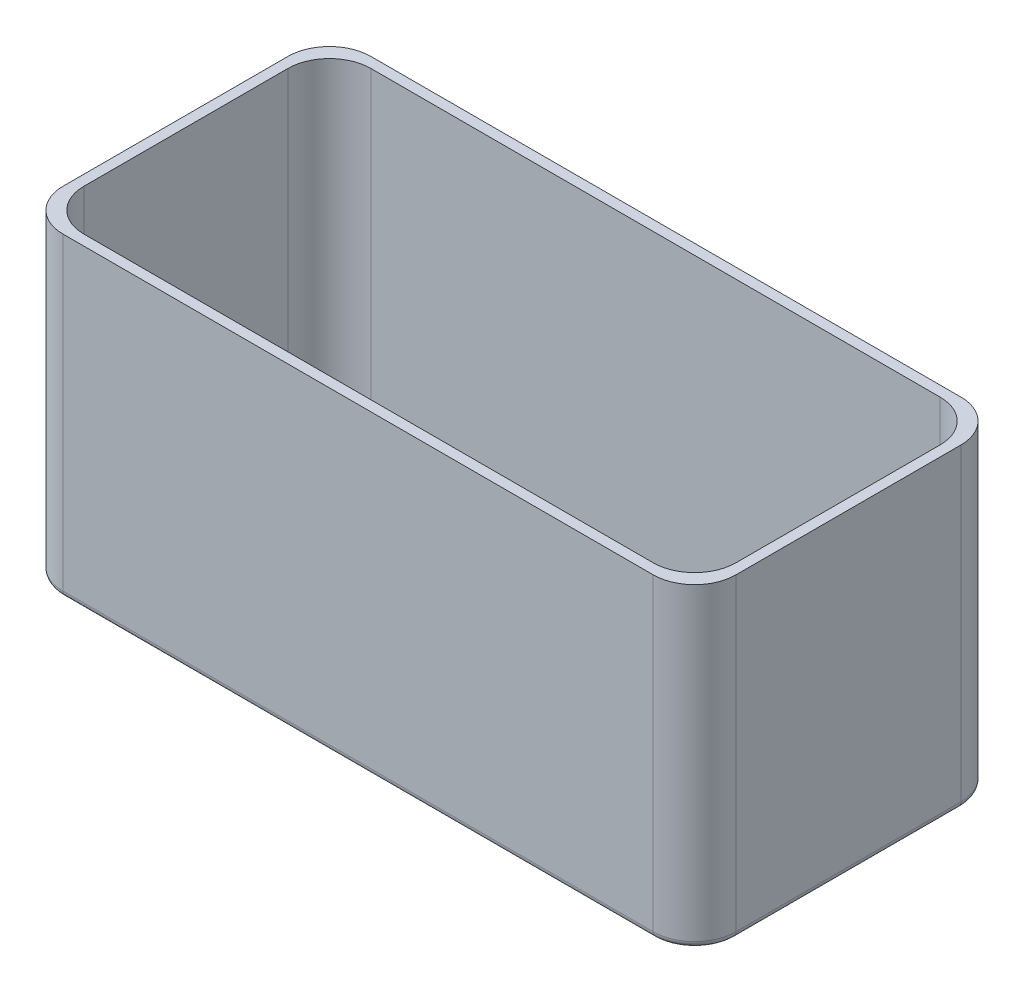
from build123d import *

# Parameters (mm, degrees)
SKETCH4_W           = 51.6
SKETCH4_H           = 23.6
SKETCH4_W_2         = 50
SKETCH4_H_2         = 22
BOSS_EXTRUDE2_DEPTH = 24.2
SKETCH4_2_W         = 50
SKETCH4_2_H         = 22
BOSS_EXTRUDE3_DEPTH = 0.8
FILLET3_R           = 3.18
FILLET4_R           = 0.5


with BuildPart() as part:
    # Sketch4 → Boss-Extrude2 (new body)
    with BuildSketch(Plane(origin=(0, 0, 0), x_dir=(1, 0, 0), z_dir=(0, 1, 0))):
        Rectangle(SKETCH4_W, SKETCH4_H)
        Rectangle(SKETCH4_W_2, SKETCH4_H_2, mode=Mode.SUBTRACT)
    extrude(amount=BOSS_EXTRUDE2_DEPTH)

    # Sketch4<2> → Boss-Extrude3 (add)
    with BuildSketch(Plane(origin=(0, 0, 0), x_dir=(1, 0, 0), z_dir=(0, 1, 0))):
        Rectangle(SKETCH4_2_W, SKETCH4_2_H)
    extrude(amount=BOSS_EXTRUDE3_DEPTH)

    # Fillet3
    fillet3_edges = [part.edges().sort_by_distance(p)[0] for p in [
        (25.8, 12.1, 11.8),
        (25.8, 12.1, -11.8),
        (25, 12.5, -11),
        (-25, 12.5, 11),
        (-25, 12.5, -11),
        (25, 12.5, 11),
        (-25.8, 12.1, 11.8),
        (-25.8, 12.1, -11.8),
    ]]
    fillet(fillet3_edges, radius=FILLET3_R)

    # Fillet4
    fillet4_edges = [part.edges().sort_by_distance(p)[0] for p in [
        (-24.868599564, 0, 10.868599564),
        (-25.8, 0, 0),
        (-24.868599564, 0, -10.868599564),
        (0, 0, -11.8),
        (24.868599564, 0, -10.868599564),
        (25.8, 0, 0),
        (24.868599564, 0, 10.868599564),
        (-24.068599564, 0.8, -10.068599564),
        (0, 0.8, -11),
        (24.068599564, 0.8, -10.068599564),
        (25, 0.8, 0),
        (24.068599564, 0.8, 10.068599564),
        (0, 0.8, 11),
        (-24.068599564, 0.8, 10.068599564),
        (0, 0, 11.8),
        (-25, 0.8, 0),
    ]]
    fillet(fillet4_edges, radius=FILLET4_R)


solid = part.part
